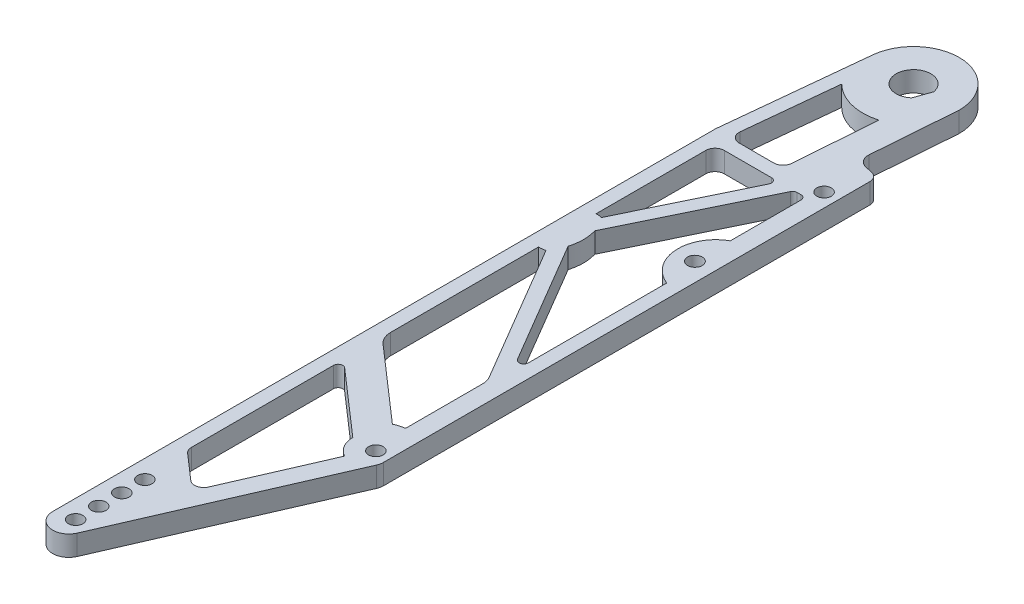
from build123d import *

# Parameters (mm, degrees)
SKETCH2_R           = 2
SKETCH2_R_2         = 1.999999991
BOSS_EXTRUDE1_DEPTH = 5.588
SKETCH7_R           = 2.032
CUT_EXTRUDE1_DEPTH  = 5.588


with BuildPart() as part:
    # Sketch2 → Boss-Extrude1 (new body)
    with BuildSketch(Plane(origin=(0, 0, 0), x_dir=(1, 0, 0), z_dir=(0, 1, 0))):
        with BuildLine():
            ThreePointArc((17.295902343, -29.323452593), (16.73639375, -27.733089808), (15.304363929, -26.843373987))
            Line((15.304363929, -26.843373987), (13.284423018, -26.396670406))
            ThreePointArc((13.284423018, -26.396670406), (11.420627025, -25.189010374), (10.804170553, -23.055431298))
            Line((10.804170553, -23.055431298), (12.5603, 0))
            ThreePointArc((12.5603, 0), (0.640974044, 12.543934326), (-12.49487995, 1.28027775))
            Line((-12.49487995, 1.28027775), (-16.496770465, -37.776201638))
            ThreePointArc((-16.496770465, -37.776201638), (-16.50669046, -37.90548449), (-16.51, -38.035105126))
            Line((-16.51, -38.035105126), (-16.51, -220.313887427))
            ThreePointArc((-16.51, -220.313887427), (-12.970187584, -224.665744552), (-7.988667969, -222.086327038))
            Line((-7.988667969, -222.086327038), (16.979901226, -164.662549258))
            ThreePointArc((16.979901226, -164.662549258), (17.216065593, -163.919190378), (17.295902343, -163.143315306))
            Line((17.295902343, -163.143315306), (17.295902343, -29.323452593))
        make_face()
        with Locations(Location((-11.43, -219.075, 0), (0, 0, 270))):
            Circle(SKETCH2_R, mode=Mode.SUBTRACT)
        with Locations(Location((-11.43, -212.725, 0), (0, 0, 270))):
            Circle(SKETCH2_R, mode=Mode.SUBTRACT)
        with Locations(Location((-11.43, -206.375, 0), (0, 0, 270))):
            Circle(SKETCH2_R, mode=Mode.SUBTRACT)
        with Locations(Location((-11.43, -200.025, 0), (0, 0, 270))):
            Circle(SKETCH2_R, mode=Mode.SUBTRACT)
        with BuildLine():
            ThreePointArc((7.135902343, -161.395796446), (8.023611961, -164.633987883), (10.438542905, -166.966801782))
            Line((10.438542905, -166.966801782), (-0.894016375, -193.029903785))
            ThreePointArc((-0.894016375, -193.029903785), (-2.665854515, -194.495144898), (-4.89449504, -193.929898651))
            Line((-4.89449504, -193.929898651), (-11.831146076, -187.869646091))
            ThreePointArc((-11.831146076, -187.869646091), (-12.472607947, -187.007278248), (-12.7, -185.95682859))
            Line((-12.7, -185.95682859), (-12.7, -146.861981888))
            ThreePointArc((-12.7, -146.861981888), (-11.955224829, -145.705677915), (-10.594426962, -145.905573138))
            Line((-10.594426962, -145.905573138), (7.135902343, -161.395796446))
        make_face(mode=Mode.SUBTRACT)
        with BuildLine():
            ThreePointArc((12.215902343, -151.955842791), (10.785297541, -152.261664921), (9.418398214, -152.782955151))
            Line((9.418398214, -152.782955151), (-10.962292152, -134.977225798))
            ThreePointArc((-10.962292152, -134.977225798), (-12.245215894, -133.252490112), (-12.7, -131.151590796))
            Line((-12.7, -131.151590796), (-12.7, -90.4875))
            ThreePointArc((-12.7, -90.4875), (-11.765673597, -90.432318214), (-10.844338135, -90.267540106))
            Line((-10.844338135, -90.267540106), (11.513275375, -128.23323342))
            ThreePointArc((11.513275375, -128.23323342), (12.037098881, -129.475107855), (12.215902343, -130.811024207))
            Line((12.215902343, -130.811024207), (12.215902343, -151.955842791))
        make_face(mode=Mode.SUBTRACT)
        with Locations(Location((13.485902343, -161.395796446, 0), (0, 0, 270))):
            Circle(SKETCH2_R, mode=Mode.SUBTRACT)
        with BuildLine():
            Line((-10.16, -41.91), (2.838491406, -41.91))
            ThreePointArc((2.838491406, -41.91), (3.914572403, -42.505500417), (3.981509018, -43.733543799))
            Line((3.981509018, -43.733543799), (-11.055993219, -74.784618621))
            ThreePointArc((-11.055993219, -74.784618621), (-11.873503915, -74.655646925), (-12.7, -74.6125))
            Line((-12.7, -74.6125), (-12.7, -44.45))
            ThreePointArc((-12.7, -44.45), (-11.956051224, -42.653948776), (-10.16, -41.91))
        make_face(mode=Mode.SUBTRACT)
        with BuildLine():
            ThreePointArc((-9.886442157, -38.1), (-11.771808813, -37.262055396), (-12.413212622, -35.301096512))
            Line((-12.413212622, -35.301096512), (-9.81475239, -9.941405108))
            ThreePointArc((-9.81475239, -9.941405108), (-3.431386466, -13.542026692), (3.896359547, -13.415635739))
            Line((3.896359547, -13.415635739), (2.194931831, -35.752912681))
            ThreePointArc((2.194931831, -35.752912681), (1.388767881, -37.42300808), (-0.337731726, -38.1))
            Line((-0.337731726, -38.1), (-9.886442157, -38.1))
        make_face(mode=Mode.SUBTRACT)
        with BuildLine():
            ThreePointArc((3.111707299, -3.622128204), (-4.505881672, 1.581001391), (4.69270869, 0.883753468))
            Line((4.69270869, 0.883753468), (3.111707299, -3.622128204))
        make_face(mode=Mode.SUBTRACT)
        with BuildLine():
            ThreePointArc((-8.804706991, -86.222769023), (-8.262040897, -82.55), (-8.804706991, -78.877230977))
            Line((-8.804706991, -78.877230977), (8.75092063, -42.626456201))
            ThreePointArc((8.75092063, -42.626456201), (9.219438659, -42.103919003), (9.893938242, -41.91))
            Line((9.893938242, -41.91), (10.945902343, -41.91))
            ThreePointArc((10.945902343, -41.91), (11.843927955, -42.281974388), (12.215902343, -43.18))
            Line((12.215902343, -43.18), (12.215902343, -62.618124667))
            ThreePointArc((12.215902343, -62.618124667), (6.906756389, -72.428110561), (13.516748759, -81.413145613))
            Line((13.516748759, -81.413145613), (13.516748759, -119.431411199))
            ThreePointArc((13.516748759, -119.431411199), (12.599191369, -120.688899116), (11.152950849, -120.113072943))
            Line((11.152950849, -120.113072943), (-8.804706991, -86.222769023))
        make_face(mode=Mode.SUBTRACT)
        with Locations(Location((13.485902343, -38.1, 0), (0, 0, 270))):
            Circle(SKETCH2_R_2, mode=Mode.SUBTRACT)
    extrude(amount=BOSS_EXTRUDE1_DEPTH)

    # Sketch7 → Cut-Extrude1 (cut)
    with BuildSketch(Plane(origin=(0, 5.588, 0), x_dir=(1, 0, 0), z_dir=(0, 1, 0))):
        with Locations(Location((12.215902343, -72.362149281, 0), (0, 0, 270))):
            Circle(SKETCH7_R)
    extrude(amount=-CUT_EXTRUDE1_DEPTH, mode=Mode.SUBTRACT)


solid = part.part
